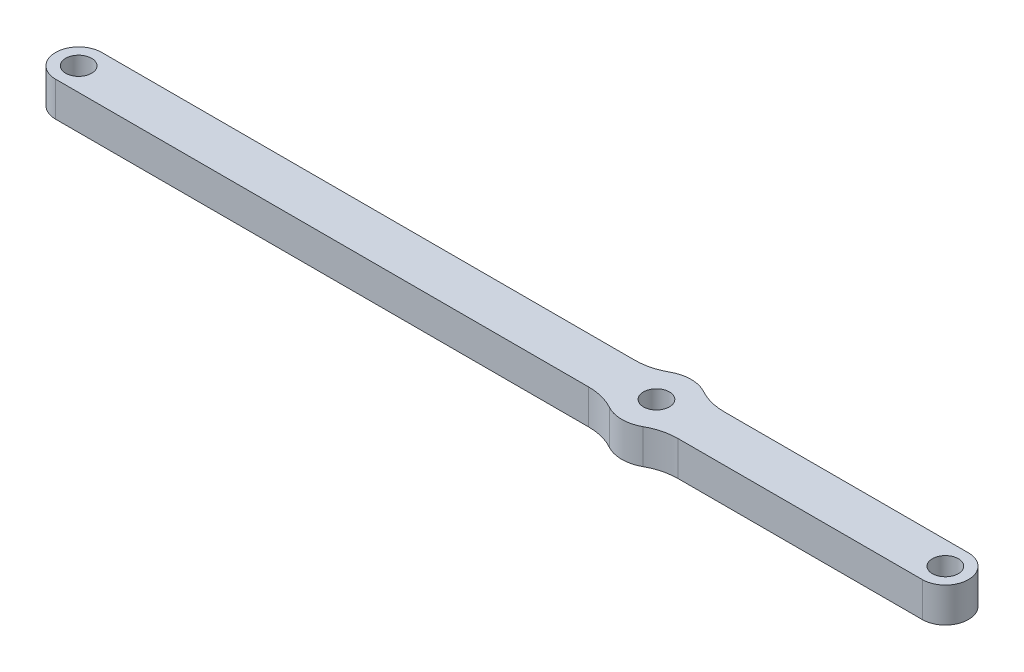
from build123d import *

# Parameters (mm, degrees)
SKETCH1_R           = 2.25
BOSS_EXTRUDE1_DEPTH = 6
FILLET1_R           = 10


with BuildPart() as part:
    # Sketch1 → Boss-Extrude1 (new body)
    with BuildSketch(Plane(origin=(0, 0, 0), x_dir=(1, 0, 0), z_dir=(0, 1, 0))):
        with BuildLine():
            Line((-100, 4), (-4.472135955, 4))
            ThreePointArc((-4.472135955, 4), (0, 6), (4.472135955, 4))
            Line((4.472135955, 4), (50, 4))
            ThreePointArc((50, 4), (54, 0), (50, -4))
            Line((50, -4), (4.472135955, -4))
            ThreePointArc((4.472135955, -4), (0, -6), (-4.472135955, -4))
            Line((-4.472135955, -4), (-100, -4))
            ThreePointArc((-100, -4), (-104, 0), (-100, 4))
        make_face()
        with Locations(Location((0, 0, 0), (0, 0, 270))):
            Circle(SKETCH1_R, mode=Mode.SUBTRACT)
        with Locations(Location((50, 0, 0), (0, 0, 270))):
            Circle(SKETCH1_R, mode=Mode.SUBTRACT)
        with Locations(Location((-100, 0, 0), (0, 0, 270))):
            Circle(SKETCH1_R, mode=Mode.SUBTRACT)
    extrude(amount=BOSS_EXTRUDE1_DEPTH)

    # Fillet1
    fillet1_edges = [part.edges().sort_by_distance(p)[0] for p in [
        (4.472135955, 3, -4),
        (4.472135955, 3, 4),
        (-4.472135955, 3, 4),
        (-4.472135955, 3, -4),
    ]]
    fillet(fillet1_edges, radius=FILLET1_R)


solid = part.part
